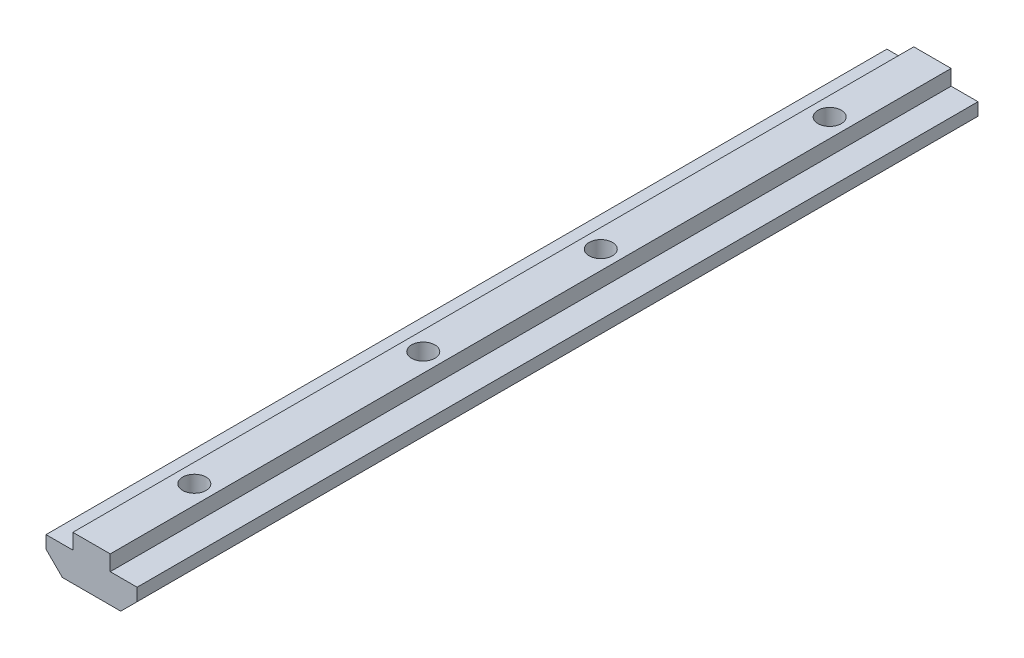
from build123d import *

# Parameters (mm, degrees)
EXTRUDE_1_DEPTH        = 180
HOLE_WIZARD_M6_1_D     = 5
HOLE_WIZARD_M6_1_DEPTH = 28
HOLE_WIZARD_M6_1_TIP   = 1.502151548


with BuildPart() as part:
    # 草图1 → 凸台-拉伸1 (new body)
    with BuildSketch(Plane.XY):
        Polygon((12.5, 0), (0, 0), (-3.5, 3.5), (-3.5, 6.2), (2.25, 6.2), (2.25, 9.5), (10.25, 9.5), (10.25, 6.2), (16, 6.2), (16, 3.5), align=None)
    extrude(amount=EXTRUDE_1_DEPTH)

    # M6 螺纹孔1
    with Locations(Plane(origin=(6.25, 9.5, 158), x_dir=(0, 0, 1), z_dir=(0, 1, 0))):
        with Locations((0, 0), (-49, 0), (-136, 0), (-87, 0)):
            Hole(HOLE_WIZARD_M6_1_D / 2, depth=HOLE_WIZARD_M6_1_DEPTH)
            with Locations((0, 0, -(HOLE_WIZARD_M6_1_DEPTH + HOLE_WIZARD_M6_1_TIP / 2))):  # 118° drill point
                Cone(0, HOLE_WIZARD_M6_1_D / 2, HOLE_WIZARD_M6_1_TIP, mode=Mode.SUBTRACT)


solid = part.part
